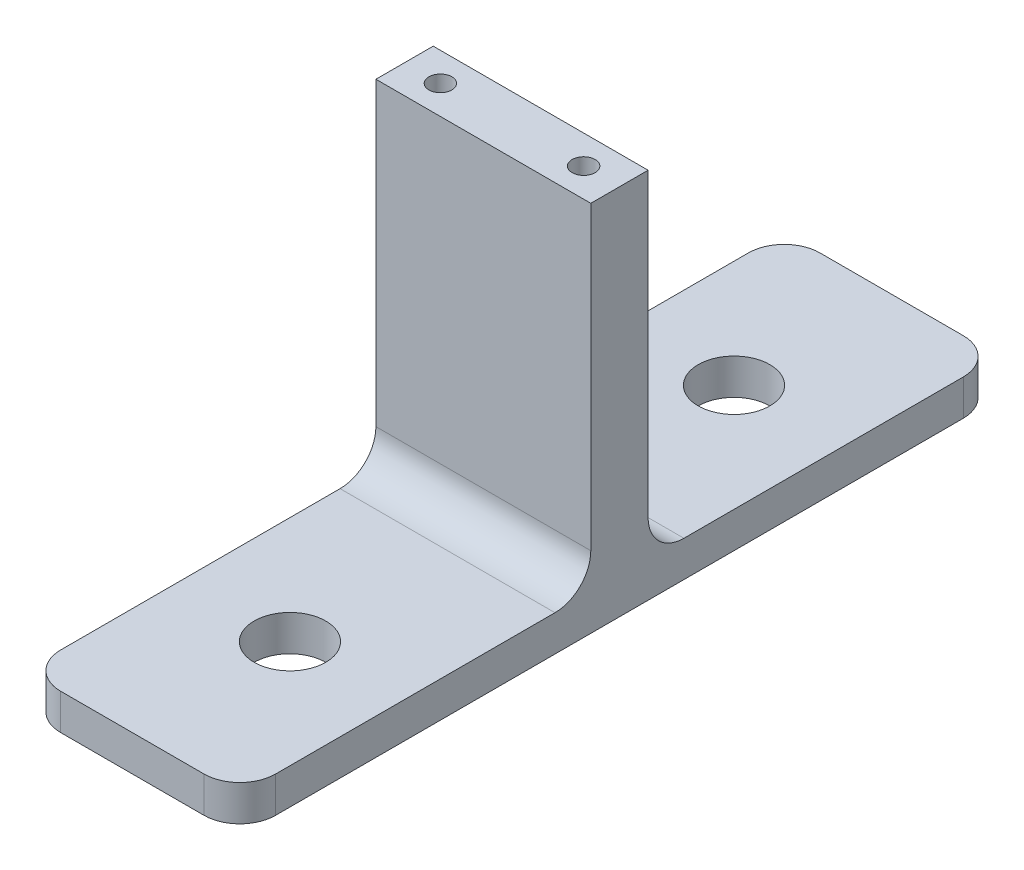
from build123d import *

# Parameters (mm, degrees)
SKETCH1_W           = 57
SKETCH1_H           = 5
BOSS_EXTRUDE1_DEPTH = 30
SKETCH2_W           = 30
SKETCH2_H           = 8
BOSS_EXTRUDE2_DEPTH = 47
SKETCH3_R           = 5
CUT_EXTRUDE1_DEPTH  = 80.737067917
SKETCH5_R           = 1.6
CUT_EXTRUDE3_DEPTH  = 14
FILLET1_R           = 5
FILLET2_R           = 5


with BuildPart() as part:
    # Sketch1 → Boss-Extrude1 (new body)
    with BuildSketch(Plane(origin=(0, 0, 0), x_dir=(0, 0, -1), z_dir=(1, 0, 0))):
        with Locations((28.5, 2.5)):
            Rectangle(SKETCH1_W, SKETCH1_H)
    boss_extrude1 = extrude(amount=BOSS_EXTRUDE1_DEPTH)

    # Sketch2 → Boss-Extrude2 (add)
    with BuildSketch(Plane(origin=(0, 5, 0), x_dir=(1, 0, 0), z_dir=(0, 1, 0))):
        with Locations((15, 53)):
            Rectangle(SKETCH2_W, SKETCH2_H)
    extrude(amount=BOSS_EXTRUDE2_DEPTH)

    # Sketch3 → Cut-Extrude1 (cut, through all)
    with BuildSketch(Plane(origin=(0, 5, 0), x_dir=(1, 0, 0), z_dir=(0, 1, 0))):
        with Locations(Location((15, 22, 0), (0, 0, 270))):
            Circle(SKETCH3_R)
    cut_extrude1 = extrude(amount=-CUT_EXTRUDE1_DEPTH, mode=Mode.SUBTRACT)

    # Sketch5 → Cut-Extrude3 (cut)
    with BuildSketch(Plane(origin=(0, 52, 0), x_dir=(1, 0, 0), z_dir=(0, 1, 0))):
        with Locations(Location((5, 53, 0), (0, 0, 270))):
            Circle(SKETCH5_R)
        with Locations(Location((25, 53, 0), (0, 0, 270))):
            Circle(SKETCH5_R)
    extrude(amount=-CUT_EXTRUDE3_DEPTH, mode=Mode.SUBTRACT)

    # Fillet1
    fillet1_edges = [part.edges().sort_by_distance(p)[0] for p in [
        (15, 5, -49),
        (30, 2.5, 0),
        (0, 2.5, 0),
        (15, 0, -57),
    ]]
    fillet(fillet1_edges, radius=FILLET1_R)

    # Mirror1: Boss-Extrude1, Cut-Extrude1 across plane
    add(boss_extrude1.mirror(Plane(origin=(0, 0, -53), x_dir=(1, 0, 0), z_dir=(0, 0, -1))))
    add(cut_extrude1.mirror(Plane(origin=(0, 0, -53), x_dir=(1, 0, 0), z_dir=(0, 0, -1))), mode=Mode.SUBTRACT)

    # Fillet2
    fillet2_edges = [part.edges().sort_by_distance(p)[0] for p in [
        (15, 5, -57),
        (0, 2.5, -106),
        (30, 2.5, -106),
    ]]
    fillet(fillet2_edges, radius=FILLET2_R)


solid = part.part
